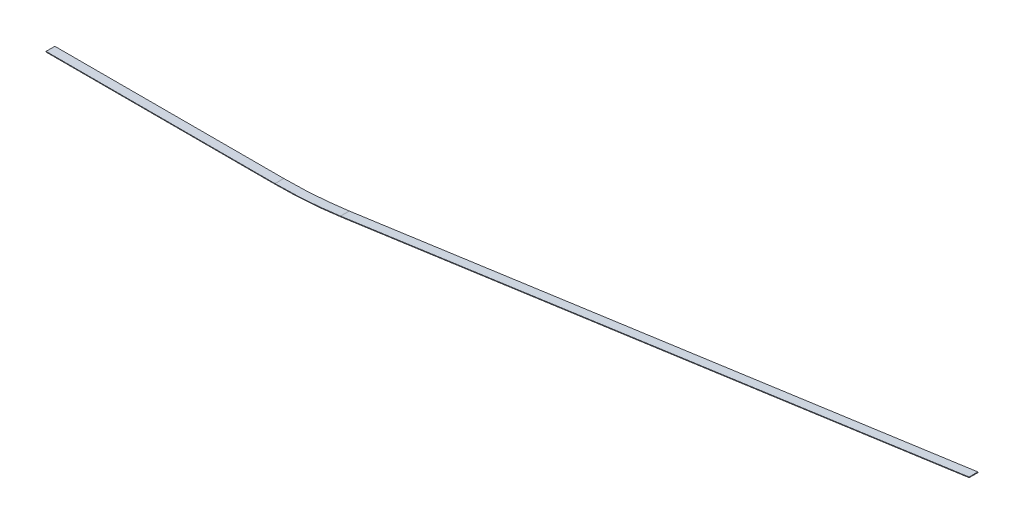
from build123d import *

# Parameters (mm, degrees)
BOSS_EXTRUDE1_DEPTH = 9.525


with BuildPart() as part:
    # Sketch1 → Boss-Extrude1 (new body)
    with BuildSketch(Plane.XY):
        with BuildLine():
            Line((5501.692216973, 2965.867398951), (5501.692216973, 2966.502398951))
            Line((5501.692216973, 2966.502398951), (5748.744396506, 2966.502398951))
            ThreePointArc((5748.744396506, 2966.502398951), (5784.180685168, 2967.739861419), (5819.444331794, 2971.44622003))
            Line((5819.444331794, 2971.44622003), (6497.642216973, 3066.760716907))
            Line((6497.642216973, 3066.760716907), (6497.730591893, 3066.131896683))
            Line((6497.730591893, 3066.131896683), (5819.532706713, 2970.817399806))
            ThreePointArc((5819.532706713, 2970.817399806), (5784.224980529, 2967.106408247), (5748.744396506, 2965.867398951))
            Line((5748.744396506, 2965.867398951), (5501.692216973, 2965.867398951))
        make_face()
    extrude(amount=BOSS_EXTRUDE1_DEPTH)


solid = part.part
